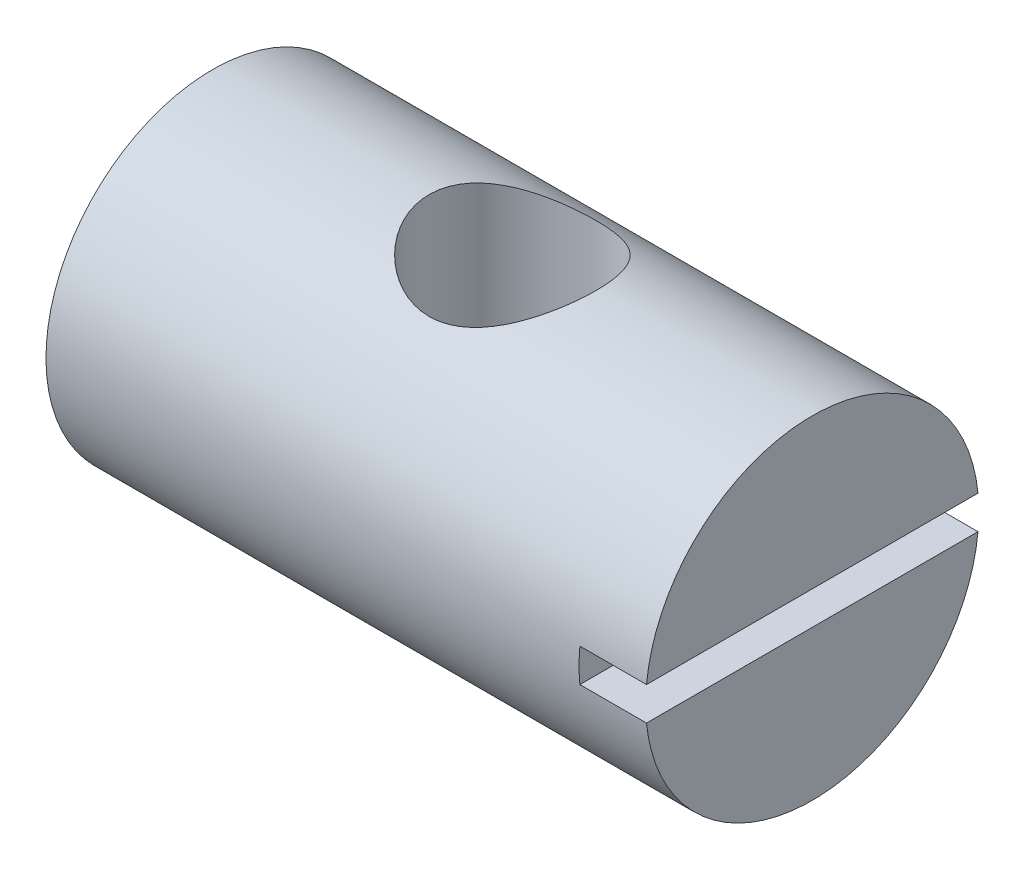
from build123d import *

# Parameters (mm, degrees)
BOSS_EXTRUDE1_DEPTH      = 9
BOSS_EXTRUDE1_DEPTH_BACK = 9
SKETCH1_R                = 5
CUT_EXTRUDE1_DEPTH       = 12.445523142
CUT_EXTRUDE1_DEPTH_BACK  = 12.445523142
SKETCH7_R                = 2.5
SKETCH8_W                = 10.865587176
SKETCH8_H                = 1
CUT_EXTRUDE2_DEPTH       = 2


with BuildPart() as part:
    # Sketch1 → Boss-Extrude1 (new, two sides: drawn at the far end of the back side and taken through both)
    with BuildSketch(Plane(origin=(0, 0, 0), x_dir=(0, 0, -1), z_dir=(1, 0, 0)).offset(-BOSS_EXTRUDE1_DEPTH_BACK)):
        Circle(SKETCH1_R)
    extrude(amount=BOSS_EXTRUDE1_DEPTH + BOSS_EXTRUDE1_DEPTH_BACK)

    # Sketch7 → Cut-Extrude1 (cut, two sides: drawn at the far end of the back side and taken through both)
    with BuildSketch(Plane(origin=(0, 0, 0), x_dir=(1, 0, 0), z_dir=(0, 1, 0)).offset(-CUT_EXTRUDE1_DEPTH_BACK)):
        Circle(SKETCH7_R)
    extrude(amount=CUT_EXTRUDE1_DEPTH + CUT_EXTRUDE1_DEPTH_BACK, mode=Mode.SUBTRACT)

    # Sketch8 → Cut-Extrude2 (cut)
    with BuildSketch(Plane(origin=(9, 0, 0), x_dir=(0, 0, -1), z_dir=(1, 0, 0))):
        Rectangle(SKETCH8_W, SKETCH8_H)
    extrude(amount=-CUT_EXTRUDE2_DEPTH, mode=Mode.SUBTRACT)


solid = part.part
